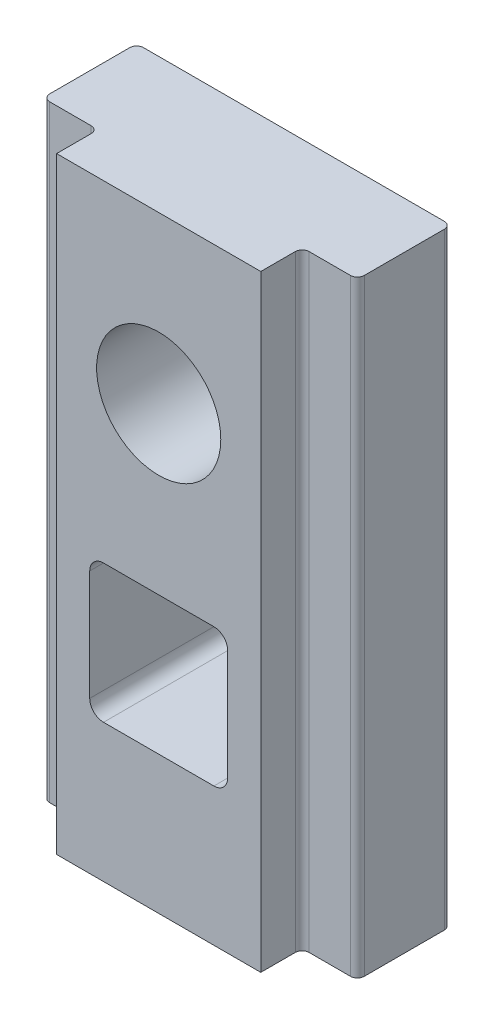
from build123d import *

# Parameters (mm, degrees)
BOSS_EXTRUDE1_DEPTH = 22
SKETCH2_R           = 2.25
SKETCH2_W           = 5
SKETCH2_H           = 5
CUT_EXTRUDE1_DEPTH  = 24.248655875
FILLET1_R           = 0.25
FILLET2_R           = 0.5


with BuildPart() as part:
    # Sketch1 → Boss-Extrude1 (new body)
    with BuildSketch(Plane(origin=(0, 0, 0), x_dir=(1, 0, 0), z_dir=(0, 1, 0))):
        Polygon((3.7, 0.3), (3.7, -1.2), (-3.7, -1.2), (-3.7, 0.3), (-5.7, 0.3), (-5.7, 3.7), (5.7, 3.7), (5.7, 0.3), align=None)
    extrude(amount=-BOSS_EXTRUDE1_DEPTH)

    # Sketch2 → Cut-Extrude1 (cut, through all)
    with BuildSketch(Plane.XY.offset(1.2)):
        with Locations((0, -6)):
            Circle(SKETCH2_R)
        with Locations((0, -14.5)):
            Rectangle(SKETCH2_W, SKETCH2_H)
    extrude(amount=-CUT_EXTRUDE1_DEPTH, mode=Mode.SUBTRACT)

    # Fillet1
    fillet1_edges = [part.edges().sort_by_distance(p)[0] for p in [
        (3.7, -11, -0.3),
        (-3.7, -11, -0.3),
        (-5.7, -11, -0.3),
        (-5.7, -11, -3.7),
        (5.7, -11, -3.7),
        (5.7, -11, -0.3),
    ]]
    fillet(fillet1_edges, radius=FILLET1_R)

    # Fillet2
    fillet2_edges = [part.edges().sort_by_distance(p)[0] for p in [
        (2.5, -12, -1.25),
        (2.5, -17, -1.25),
        (-2.5, -17, -1.25),
        (-2.5, -12, -1.25),
    ]]
    fillet(fillet2_edges, radius=FILLET2_R)


solid = part.part
